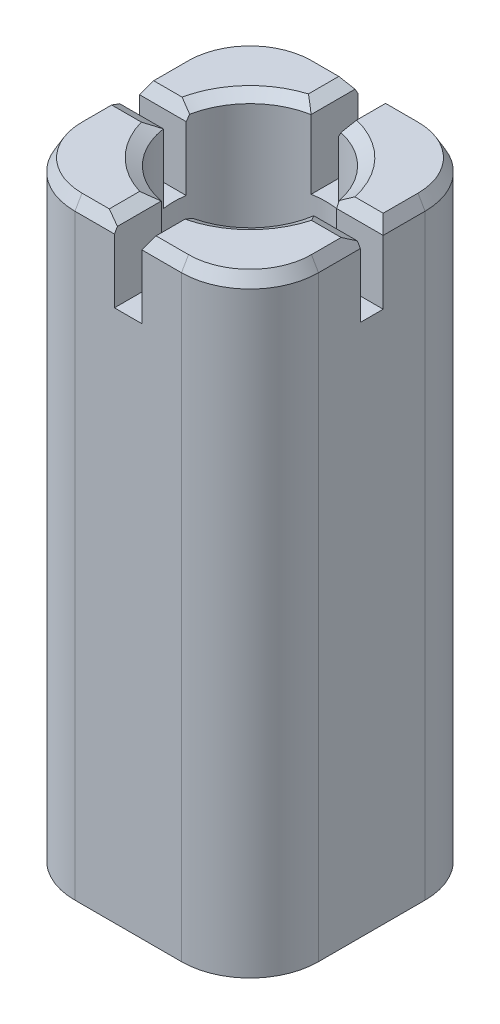
from build123d import *
from OCP.BRepFilletAPI import BRepFilletAPI_MakeChamfer

# Parameters (mm, degrees)
SKETCH1_W           = 16
SKETCH1_H           = 16
SKETCH1_R           = 5
BOSS_EXTRUDE1_DEPTH = 40
FILLET1_R           = 4.5
CUT_EXTRUDE1_START  = -5
CUT_EXTRUDE1_DEPTH  = 5
CHAMFER1_SIZE       = 0.8
CHAMFER1_SIZE2      = 0.461880215
CHAMFER2_SIZE       = 0.8
CHAMFER2_SIZE2      = 0.461880215
SKETCH3_R           = 5
SKETCH3_R_2         = 4.5
BOSS_EXTRUDE2_DEPTH = 15
SKETCH4_R           = 7.25
CUT_EXTRUDE2_DEPTH  = 2


with BuildPart() as part:
    # Sketch1 → Boss-Extrude1 (new body)
    with BuildSketch(Plane(origin=(0, 0, 0), x_dir=(1, 0, 0), z_dir=(0, 1, 0))):
        Rectangle(SKETCH1_W, SKETCH1_H)
        with Locations(Location((0, 0, 0), (0, 0, 270))):
            Circle(SKETCH1_R, mode=Mode.SUBTRACT)
    extrude(amount=BOSS_EXTRUDE1_DEPTH)

    # Fillet1
    fillet1_edges = [part.edges().sort_by_distance(p)[0] for p in [
        (8, 20, 8),
        (-8, 20, 8),
        (-8, 20, -8),
        (8, 20, -8),
    ]]
    fillet(fillet1_edges, radius=FILLET1_R)

    # Sketch2 → Cut-Extrude1 (cut)
    with BuildSketch(Plane(origin=(0, 40, 0), x_dir=(1, 0, 0), z_dir=(0, 1, 0)).offset(CUT_EXTRUDE1_START)):
        with BuildLine():
            ThreePointArc((5, 0), (4.985837438, -0.376065209), (4.943429983, -0.75))
            Line((4.943429983, -0.75), (8, -0.75))
            Line((8, -0.75), (8, 0.75))
            Line((8, 0.75), (4.943429983, 0.75))
            ThreePointArc((4.943429983, 0.75), (4.985837438, 0.376065209), (5, 0))
        make_face()
        with BuildLine():
            Line((-0.904749438, 8), (-0.904749438, 4.917461586))
            ThreePointArc((-0.904749438, 4.917461586), (0, 5), (0.904749438, 4.917461586))
            Line((0.904749438, 4.917461586), (0.904749438, 8))
            Line((0.904749438, 8), (-0.904749438, 8))
        make_face()
        with BuildLine():
            ThreePointArc((0.904749438, -4.917461586), (0, -5), (-0.904749438, -4.917461586))
            Line((-0.904749438, -4.917461586), (-0.904749438, -8))
            Line((-0.904749438, -8), (0.904749438, -8))
            Line((0.904749438, -8), (0.904749438, -4.917461586))
        make_face()
        with BuildLine():
            Line((-8, 0.75), (-8, -0.75))
            Line((-8, -0.75), (-4.943429983, -0.75))
            ThreePointArc((-4.943429983, -0.75), (-5, 0), (-4.943429983, 0.75))
            Line((-4.943429983, 0.75), (-8, 0.75))
        make_face()
    extrude(amount=CUT_EXTRUDE1_DEPTH, mode=Mode.SUBTRACT)

    # Chamfer1: one chamfer whose edges measure the first distance from different faces: ONE call of the kernel's chamfer builder (chamfer() names one face for all edges)
    chamfer1_edges_1 = [part.edges().sort_by_distance(p)[0] for p in [
        (6.471714992, 40, -0.75),
    ]]
    chamfer1_side_1 = [part.faces().sort_by_distance(p)[0] for p in [
        (6.471714992, 37.5, -0.75),
    ]]
    chamfer1_edges_2 = [part.edges().sort_by_distance(p)[0] for p in [
        (6.471714992, 40, 0.75),
    ]]
    chamfer1_side_2 = [part.faces().sort_by_distance(p)[0] for p in [
        (4.797663916, 40, 4.721192893),
    ]]
    chamfer1_edges_3 = [part.edges().sort_by_distance(p)[0] for p in [
        (0.904749438, 40, -6.458730793),
    ]]
    chamfer1_side_3 = [part.faces().sort_by_distance(p)[0] for p in [
        (0.904749438, 37.5, -6.458730793),
    ]]
    chamfer1_edges_4 = [part.edges().sort_by_distance(p)[0] for p in [
        (-0.904749438, 40, -6.458730793),
    ]]
    chamfer1_side_4 = [part.faces().sort_by_distance(p)[0] for p in [
        (-4.797663916, 40, -4.721192893),
    ]]
    chamfer1_edges_5 = [part.edges().sort_by_distance(p)[0] for p in [
        (0.904749438, 40, 6.458730793),
    ]]
    chamfer1_side_5 = [part.faces().sort_by_distance(p)[0] for p in [
        (0.904749438, 37.5, 6.458730793),
    ]]
    chamfer1_edges_6 = [part.edges().sort_by_distance(p)[0] for p in [
        (-0.904749438, 40, 6.458730793),
        (-6.471714992, 40, 0.75),
    ]]
    chamfer1_side_6 = [part.faces().sort_by_distance(p)[0] for p in [
        (-4.797663916, 40, 4.721192893),
    ]]
    chamfer1_edges_7 = [part.edges().sort_by_distance(p)[0] for p in [
        (-6.471714992, 40, -0.75),
    ]]
    chamfer1_side_7 = [part.faces().sort_by_distance(p)[0] for p in [
        (-6.471714992, 37.5, -0.75),
    ]]
    chamfer1 = BRepFilletAPI_MakeChamfer(part.part.solid().wrapped)
    for e in chamfer1_edges_1:
        chamfer1.Add(CHAMFER1_SIZE, CHAMFER1_SIZE2, e.wrapped, chamfer1_side_1[0].wrapped)  # the first distance lies on this face
    for e in chamfer1_edges_2:
        chamfer1.Add(CHAMFER1_SIZE, CHAMFER1_SIZE2, e.wrapped, chamfer1_side_2[0].wrapped)  # the first distance lies on this face
    for e in chamfer1_edges_3:
        chamfer1.Add(CHAMFER1_SIZE, CHAMFER1_SIZE2, e.wrapped, chamfer1_side_3[0].wrapped)  # the first distance lies on this face
    for e in chamfer1_edges_4:
        chamfer1.Add(CHAMFER1_SIZE, CHAMFER1_SIZE2, e.wrapped, chamfer1_side_4[0].wrapped)  # the first distance lies on this face
    for e in chamfer1_edges_5:
        chamfer1.Add(CHAMFER1_SIZE, CHAMFER1_SIZE2, e.wrapped, chamfer1_side_5[0].wrapped)  # the first distance lies on this face
    for e in chamfer1_edges_6:
        chamfer1.Add(CHAMFER1_SIZE, CHAMFER1_SIZE2, e.wrapped, chamfer1_side_6[0].wrapped)  # the first distance lies on this face
    for e in chamfer1_edges_7:
        chamfer1.Add(CHAMFER1_SIZE, CHAMFER1_SIZE2, e.wrapped, chamfer1_side_7[0].wrapped)  # the first distance lies on this face
    add(Compound.cast(chamfer1.Shape()), mode=Mode.REPLACE)

    # Chamfer2: one chamfer whose edges measure the first distance from different faces: ONE call of the kernel's chamfer builder (chamfer() names one face for all edges)
    chamfer2_edges_1 = [part.edges().sort_by_distance(p)[0] for p in [
        (-3.592924063, 40, 3.477196669),
    ]]
    chamfer2_side_1 = [part.faces().sort_by_distance(p)[0] for p in [
        (-4.956967709, 40, 4.876915228),
    ]]
    chamfer2_edges_2 = [part.edges().sort_by_distance(p)[0] for p in [
        (3.467104871, 40, 3.602663433),
    ]]
    chamfer2_side_2 = [part.faces().sort_by_distance(p)[0] for p in [
        (4.836216734, 40, 4.929925488),
    ]]
    chamfer2_edges_3 = [part.edges().sort_by_distance(p)[0] for p in [
        (3.59170795, 40, -3.478452817),
    ]]
    chamfer2_side_3 = [part.faces().sort_by_distance(p)[0] for p in [
        (4.888861893, 40, -4.810636969),
    ]]
    chamfer2_edges_4 = [part.edges().sort_by_distance(p)[0] for p in [
        (-3.713035057, 40, -3.348637136),
    ]]
    chamfer2_side_4 = [part.faces().sort_by_distance(p)[0] for p in [
        (-5.007269345, 40, -4.755258355),
    ]]
    chamfer2_edges_5 = [part.edges().sort_by_distance(p)[0] for p in [
        (-2.602374719, 40, -8),
        (2.433314827, 40, -8),
    ]]
    chamfer2_side_5 = [part.faces().sort_by_distance(p)[0] for p in [
        (7.6955e-05, 19.387827312, -8),
    ]]
    chamfer2_edges_6 = [part.edges().sort_by_distance(p)[0] for p in [
        (-8, 40, -2.355940108),
        (-8, 40, 2.525),
    ]]
    chamfer2_side_6 = [part.faces().sort_by_distance(p)[0] for p in [
        (-8, 19.4908238, -7.6518e-05),
    ]]
    chamfer2_edges_7 = [part.edges().sort_by_distance(p)[0] for p in [
        (-6.681980515, 40, -6.681980515),
    ]]
    chamfer2_side_7 = [part.faces().sort_by_distance(p)[0] for p in [
        (-6.681980515, 20, -6.681980515),
    ]]
    chamfer2_edges_8 = [part.edges().sort_by_distance(p)[0] for p in [
        (-2.602374719, 40, 8),
        (2.433314827, 40, 8),
    ]]
    chamfer2_side_8 = [part.faces().sort_by_distance(p)[0] for p in [
        (7.6955e-05, 19.387827312, 8),
    ]]
    chamfer2_edges_9 = [part.edges().sort_by_distance(p)[0] for p in [
        (-6.681980515, 40, 6.681980515),
    ]]
    chamfer2_side_9 = [part.faces().sort_by_distance(p)[0] for p in [
        (-6.681980515, 20, 6.681980515),
    ]]
    chamfer2_edges_10 = [part.edges().sort_by_distance(p)[0] for p in [
        (8, 40, 2.525),
        (8, 40, -2.355940108),
    ]]
    chamfer2_side_10 = [part.faces().sort_by_distance(p)[0] for p in [
        (8, 19.4908238, -7.6518e-05),
    ]]
    chamfer2_edges_11 = [part.edges().sort_by_distance(p)[0] for p in [
        (6.681980515, 40, 6.681980515),
    ]]
    chamfer2_side_11 = [part.faces().sort_by_distance(p)[0] for p in [
        (6.681980515, 20, 6.681980515),
    ]]
    chamfer2_edges_12 = [part.edges().sort_by_distance(p)[0] for p in [
        (6.681980515, 40, -6.681980515),
    ]]
    chamfer2_side_12 = [part.faces().sort_by_distance(p)[0] for p in [
        (6.681980515, 20, -6.681980515),
    ]]
    chamfer2 = BRepFilletAPI_MakeChamfer(part.part.solid().wrapped)
    for e in chamfer2_edges_1:
        chamfer2.Add(CHAMFER2_SIZE, CHAMFER2_SIZE2, e.wrapped, chamfer2_side_1[0].wrapped)  # the first distance lies on this face
    for e in chamfer2_edges_2:
        chamfer2.Add(CHAMFER2_SIZE, CHAMFER2_SIZE2, e.wrapped, chamfer2_side_2[0].wrapped)  # the first distance lies on this face
    for e in chamfer2_edges_3:
        chamfer2.Add(CHAMFER2_SIZE, CHAMFER2_SIZE2, e.wrapped, chamfer2_side_3[0].wrapped)  # the first distance lies on this face
    for e in chamfer2_edges_4:
        chamfer2.Add(CHAMFER2_SIZE, CHAMFER2_SIZE2, e.wrapped, chamfer2_side_4[0].wrapped)  # the first distance lies on this face
    for e in chamfer2_edges_5:
        chamfer2.Add(CHAMFER2_SIZE, CHAMFER2_SIZE2, e.wrapped, chamfer2_side_5[0].wrapped)  # the first distance lies on this face
    for e in chamfer2_edges_6:
        chamfer2.Add(CHAMFER2_SIZE, CHAMFER2_SIZE2, e.wrapped, chamfer2_side_6[0].wrapped)  # the first distance lies on this face
    for e in chamfer2_edges_7:
        chamfer2.Add(CHAMFER2_SIZE, CHAMFER2_SIZE2, e.wrapped, chamfer2_side_7[0].wrapped)  # the first distance lies on this face
    for e in chamfer2_edges_8:
        chamfer2.Add(CHAMFER2_SIZE, CHAMFER2_SIZE2, e.wrapped, chamfer2_side_8[0].wrapped)  # the first distance lies on this face
    for e in chamfer2_edges_9:
        chamfer2.Add(CHAMFER2_SIZE, CHAMFER2_SIZE2, e.wrapped, chamfer2_side_9[0].wrapped)  # the first distance lies on this face
    for e in chamfer2_edges_10:
        chamfer2.Add(CHAMFER2_SIZE, CHAMFER2_SIZE2, e.wrapped, chamfer2_side_10[0].wrapped)  # the first distance lies on this face
    for e in chamfer2_edges_11:
        chamfer2.Add(CHAMFER2_SIZE, CHAMFER2_SIZE2, e.wrapped, chamfer2_side_11[0].wrapped)  # the first distance lies on this face
    for e in chamfer2_edges_12:
        chamfer2.Add(CHAMFER2_SIZE, CHAMFER2_SIZE2, e.wrapped, chamfer2_side_12[0].wrapped)  # the first distance lies on this face
    add(Compound.cast(chamfer2.Shape()), mode=Mode.REPLACE)

    # Sketch3 → Boss-Extrude2 (add)
    with BuildSketch(Plane.XZ):
        with Locations(Location((0, 0, 0), (0, 0, 270))):
            Circle(SKETCH3_R)
        with Locations(Location((0, 0, 0), (0, 0, 270))):
            Circle(SKETCH3_R_2, mode=Mode.SUBTRACT)
    extrude(amount=-BOSS_EXTRUDE2_DEPTH)

    # Sketch4 → Cut-Extrude2 (cut)
    with BuildSketch(Plane.XZ):
        with Locations(Location((0, 0, 0), (0, 0, 270))):
            Circle(SKETCH4_R)
    extrude(amount=-CUT_EXTRUDE2_DEPTH, mode=Mode.SUBTRACT)


solid = part.part
